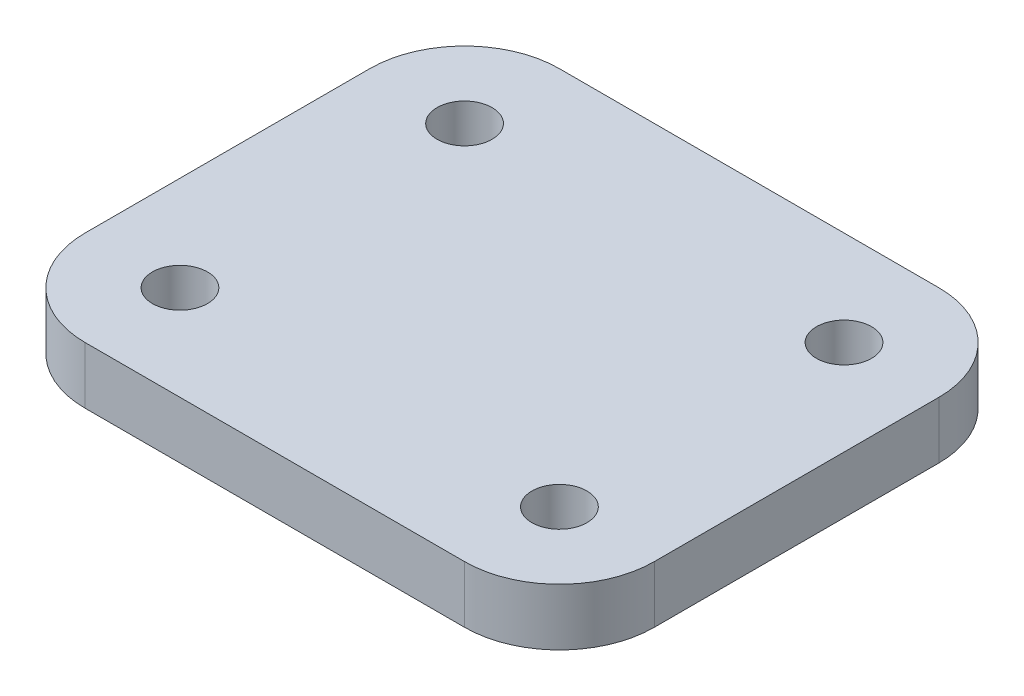
from build123d import *

# Parameters (mm, degrees)
SKETCH_1_W      = 30
SKETCH_1_H      = 25
SKETCH_1_R      = 1.45
EXTRUDE_1_DEPTH = 3
FILLET_1_R      = 5


with BuildPart() as part:
    # 草图1 → 凸台-拉伸1 (new body)
    with BuildSketch(Plane(origin=(0, 0, 0), x_dir=(1, 0, 0), z_dir=(0, 1, 0))):
        Rectangle(SKETCH_1_W, SKETCH_1_H)
        with Locations(Location((-10, 7.5, 0), (0, 0, 270))):
            Circle(SKETCH_1_R, mode=Mode.SUBTRACT)
        with Locations(Location((-10, -7.5, 0), (0, 0, 270))):
            Circle(SKETCH_1_R, mode=Mode.SUBTRACT)
        with Locations(Location((10, -7.5, 0), (0, 0, 270))):
            Circle(SKETCH_1_R, mode=Mode.SUBTRACT)
        with Locations(Location((10, 7.5, 0), (0, 0, 270))):
            Circle(SKETCH_1_R, mode=Mode.SUBTRACT)
    extrude(amount=EXTRUDE_1_DEPTH)

    # 圆角1
    fillet_1_edges = [part.edges().sort_by_distance(p)[0] for p in [
        (15, 1.5, 12.5),
        (-15, 1.5, 12.5),
        (-15, 1.5, -12.5),
        (15, 1.5, -12.5),
    ]]
    fillet(fillet_1_edges, radius=FILLET_1_R)


solid = part.part
